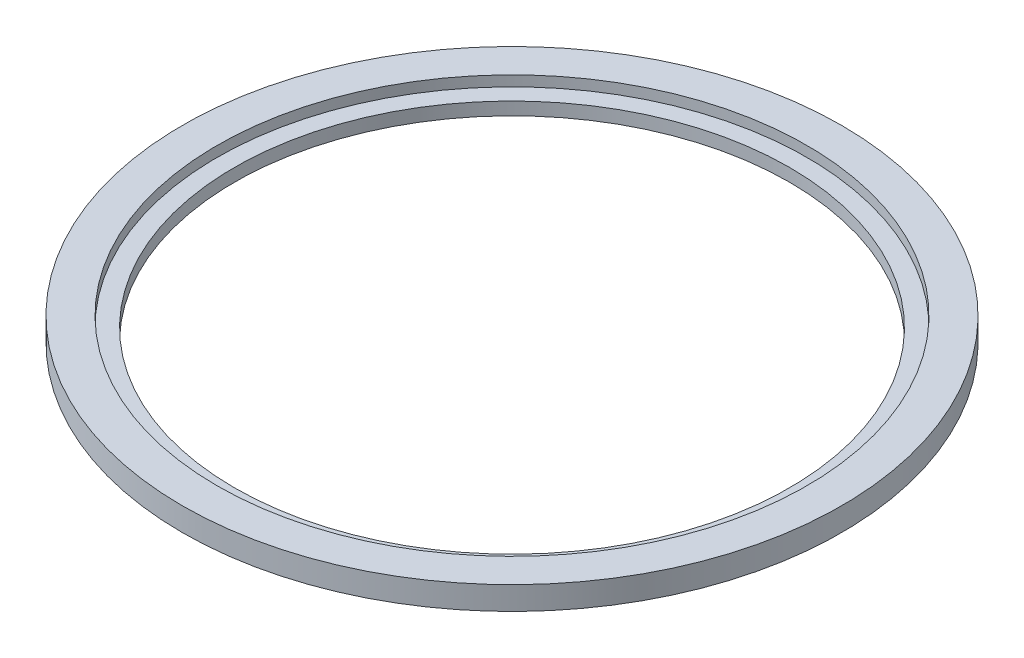
from build123d import *

# Parameters (mm, degrees)
SKETCH1_R           = 95
SKETCH1_R_2         = 80
BOSS_EXTRUDE1_DEPTH = 6.7
SKETCH2_R           = 85
CUT_EXTRUDE1_DEPTH  = 3


with BuildPart() as part:
    # Sketch1 → Boss-Extrude1 (new body)
    with BuildSketch(Plane(origin=(0, 0, 0), x_dir=(1, 0, 0), z_dir=(0, 1, 0))):
        with Locations(Location((0, 0, 0), (0, 0, 270))):
            Circle(SKETCH1_R)
        with Locations(Location((0, 0, 0), (0, 0, 270))):
            Circle(SKETCH1_R_2, mode=Mode.SUBTRACT)
    extrude(amount=BOSS_EXTRUDE1_DEPTH)

    # Sketch2 → Cut-Extrude1 (cut)
    with BuildSketch(Plane(origin=(0, 6.7, 0), x_dir=(1, 0, 0), z_dir=(0, 1, 0))):
        with Locations(Location((0, 0, 0), (0, 0, 270))):
            Circle(SKETCH2_R)
    extrude(amount=-CUT_EXTRUDE1_DEPTH, mode=Mode.SUBTRACT)


solid = part.part
